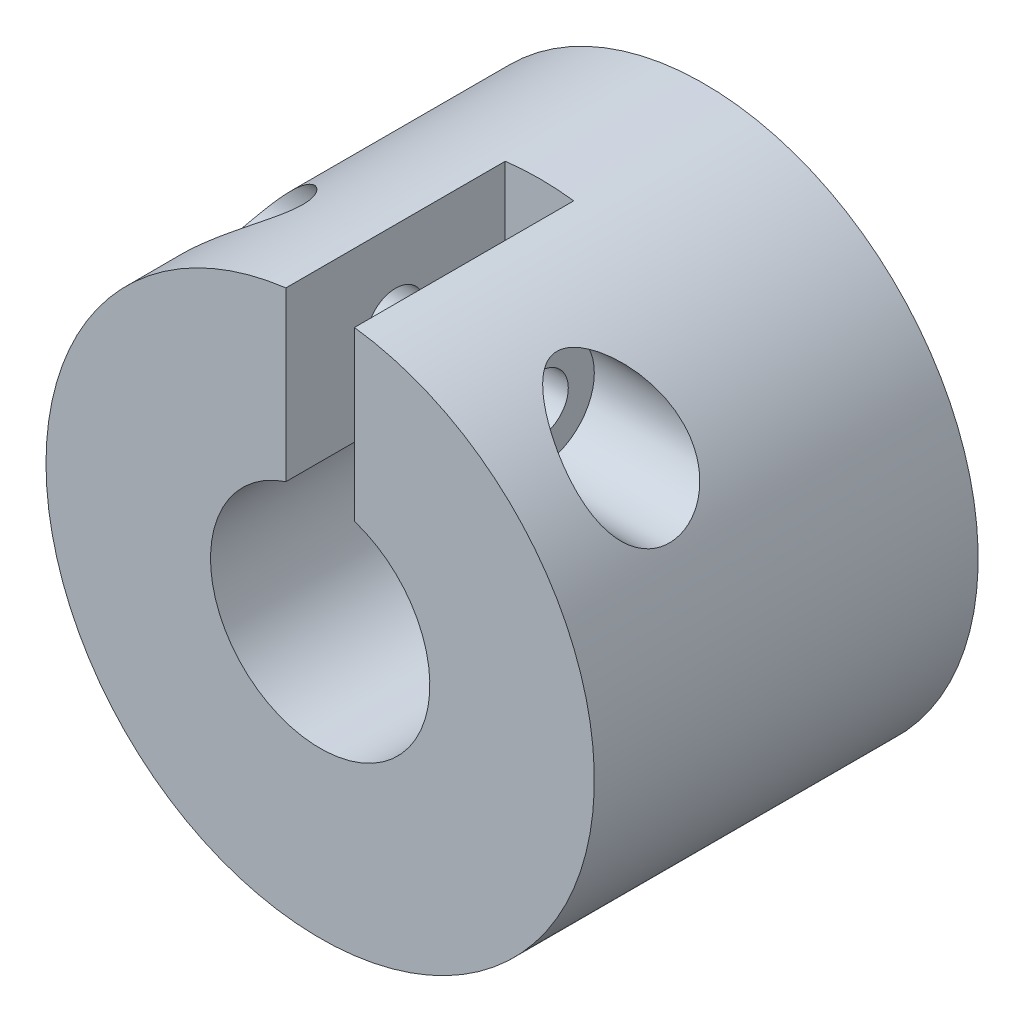
from build123d import *

# Parameters (mm, degrees)
SKETCH1_R           = 10
SKETCH1_R_2         = 4
BOSS_EXTRUDE1_DEPTH = 8
SKETCH2_W           = 2.5
SKETCH2_H           = 11.075471698
CUT_EXTRUDE1_DEPTH  = 17.248076809
SKETCH3_R           = 1.05
CUT_EXTRUDE2_DEPTH  = 24.748684174
SKETCH4_R           = 2
CUT_EXTRUDE3_DEPTH  = 6
BOSS_EXTRUDE3_START = 6
SKETCH6_R           = 10
BOSS_EXTRUDE3_DEPTH = 6


with BuildPart() as part:
    # Sketch1 → Boss-Extrude1 (new body)
    with BuildSketch(Plane.XY):
        Circle(SKETCH1_R)
        Circle(SKETCH1_R_2, mode=Mode.SUBTRACT)
    extrude(amount=BOSS_EXTRUDE1_DEPTH)

    # Sketch2 → Cut-Extrude1 (cut, through all)
    with BuildSketch(Plane.XY.offset(8)):
        with Locations((0, 5.537735849)):
            Rectangle(SKETCH2_W, SKETCH2_H)
    extrude(amount=-CUT_EXTRUDE1_DEPTH, mode=Mode.SUBTRACT)

    # Sketch3 → Cut-Extrude2 (cut, through all)
    with BuildSketch(Plane.ZY.offset(10)):
        with Locations((4, 6.860619227)):
            Circle(SKETCH3_R)
    extrude(amount=-CUT_EXTRUDE2_DEPTH, mode=Mode.SUBTRACT)

    # Sketch4 → Cut-Extrude3 (cut)
    with BuildSketch(Plane.ZY.offset(10)):
        with Locations((4, 6.860619227)):
            Circle(SKETCH4_R)
    cut_extrude3 = extrude(amount=-CUT_EXTRUDE3_DEPTH, mode=Mode.SUBTRACT)

    # Mirror1: Cut-Extrude3 across plane
    add(cut_extrude3.mirror(Plane.ZY), mode=Mode.SUBTRACT)

    # Sketch6 → Boss-Extrude3 (add)
    with BuildSketch(Plane(origin=(0, 0, 0), x_dir=(-1, 0, 0), z_dir=(0, 0, -1)).offset(BOSS_EXTRUDE3_START)):
        Circle(SKETCH6_R)
    extrude(amount=-BOSS_EXTRUDE3_DEPTH)


solid = part.part
